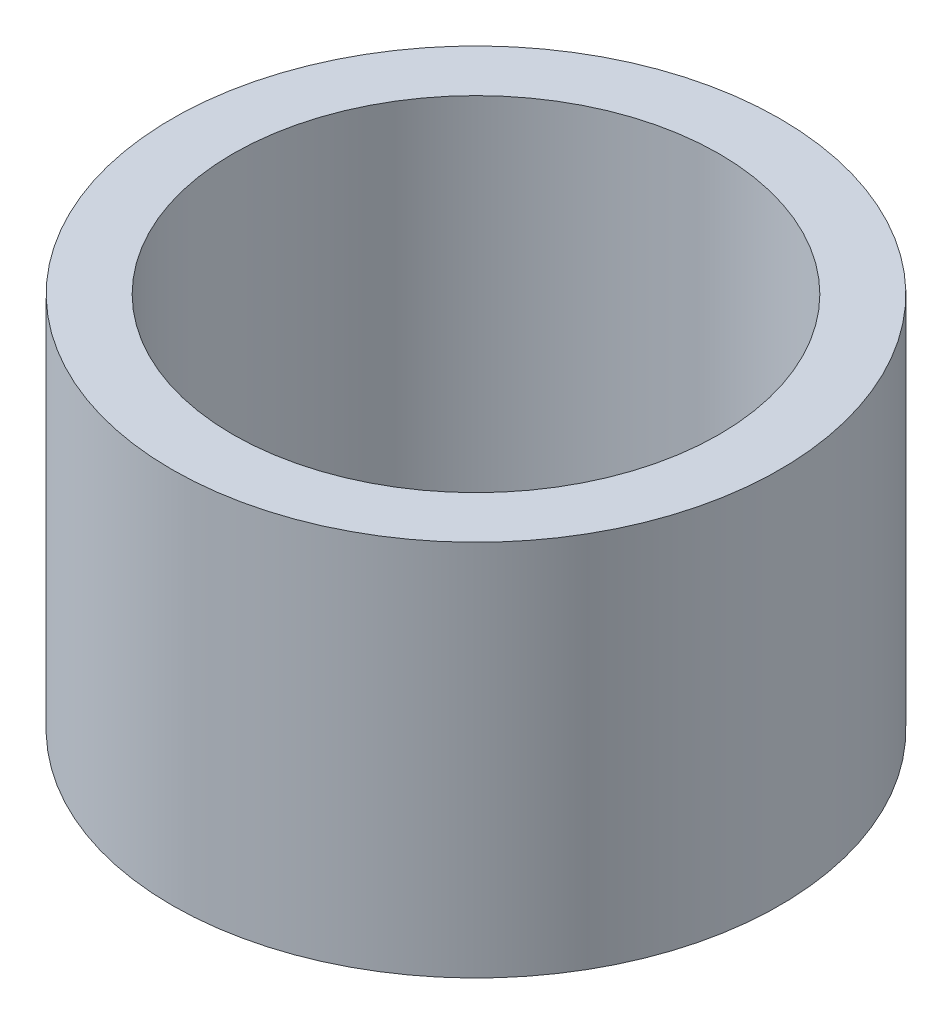
from build123d import *

# Parameters (mm, degrees)
SKETCH1_R           = 31.75
SKETCH1_R_2         = 25.4
BOSS_EXTRUDE1_DEPTH = 19.7104


with BuildPart() as part:
    # Sketch1 → Boss-Extrude1 (new, symmetric)
    with BuildSketch(Plane(origin=(0, 0, 0), x_dir=(1, 0, 0), z_dir=(0, 1, 0))):
        with Locations(Location((0, 0, 0), (0, 0, 270))):
            Circle(SKETCH1_R)
        with Locations(Location((0, 0, 0), (0, 0, 270))):
            Circle(SKETCH1_R_2, mode=Mode.SUBTRACT)
    extrude(amount=BOSS_EXTRUDE1_DEPTH, both=True)


solid = part.part
